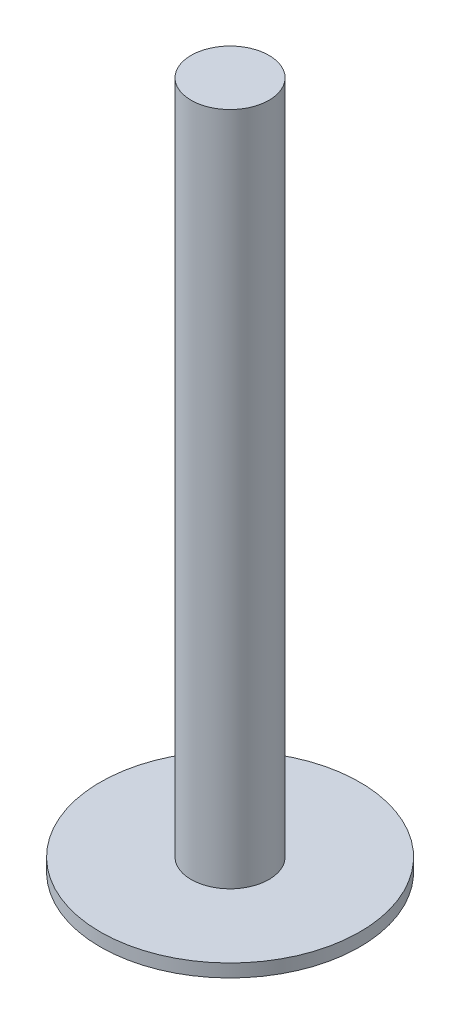
from build123d import *

# Parameters (mm, degrees)
SKETCH_1_R      = 5
EXTRUDE_1_DEPTH = 0.5
SKETCH_2_R      = 1.5
EXTRUDE_2_DEPTH = 26


with BuildPart() as part:
    # ｽｹｯﾁ1 → ﾎﾞｽ - 押し出し1 (new body)
    with BuildSketch(Plane(origin=(0, 0, 0), x_dir=(1, 0, 0), z_dir=(0, 1, 0))):
        with Locations(Location((0, 0, 0), (0, 0, 270))):
            Circle(SKETCH_1_R)
    extrude(amount=EXTRUDE_1_DEPTH)

    # ｽｹｯﾁ2 → ﾎﾞｽ - 押し出し2 (add)
    with BuildSketch(Plane(origin=(0, 0.5, 0), x_dir=(1, 0, 0), z_dir=(0, 1, 0))):
        with Locations(Location((0, 0, 0), (0, 0, 270))):
            Circle(SKETCH_2_R)
    extrude(amount=EXTRUDE_2_DEPTH)


solid = part.part
